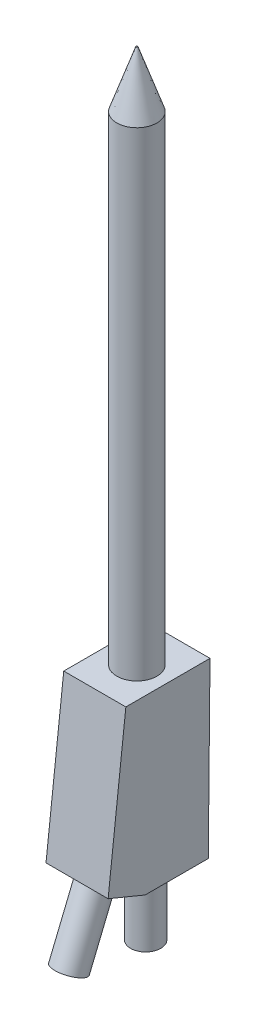
from build123d import *

# Parameters (mm, degrees)
SKETCH1_R           = 2
BOSS_EXTRUDE1_DEPTH = 50
BOSS_EXTRUDE2_DEPTH = 3.1
SKETCH4_R           = 1.5
BOSS_EXTRUDE3_DEPTH = 7
SKETCH5_R           = 1.5
BOSS_EXTRUDE4_DEPTH = 7


with BuildPart() as part:
    # Sketch1 → Boss-Extrude1 (new body)
    with BuildSketch(Plane(origin=(0, 0, 0), x_dir=(1, 0, 0), z_dir=(0, 1, 0))):
        with Locations(Location((0, 0, 0), (0, 0, 270))):
            Circle(SKETCH1_R)
    extrude(amount=BOSS_EXTRUDE1_DEPTH)

    # Sketch2 → Revolve1 (revolve)
    with BuildSketch(Plane.XY):
        Polygon((0, 55.6), (0, 50), (2, 50), (0.078528032, 55.6), align=None)
    revolve(axis=Axis((0, 55.6, 0), (0, -1, 0)))

    # Sketch3 → Boss-Extrude2 (add, symmetric)
    with BuildSketch(Plane(origin=(0, 0, 0), x_dir=(0, 0, -1), z_dir=(1, 0, 0))):
        Polygon((-4.2, 2.171539087), (4.2, 2.171539087), (4.029893124, -15.048329328), (-2.270106876, -15.048329328), (-5.970106876, -13.528460913), align=None)
    extrude(amount=BOSS_EXTRUDE2_DEPTH, both=True)

    # Sketch4 → Boss-Extrude3 (add)
    with BuildSketch(Plane(origin=(0, -13.673600271, 5.616776534), x_dir=(-1, 0, 0), z_dir=(0, -0.9250000000000002, 0.37996710383926635))):
        with Locations(Location((0, 1.618021252, 0), (0, 0, 270))):
            Circle(SKETCH4_R)
    extrude(amount=BOSS_EXTRUDE3_DEPTH)

    # Sketch5 → Boss-Extrude4 (add)
    with BuildSketch(Plane(origin=(0, -15.048329328, 0), x_dir=(-1, 0, 0), z_dir=(0, -1, 0))):
        with Locations(Location((0, 0.879893124, 0), (0, 0, 270))):
            Circle(SKETCH5_R)
    extrude(amount=BOSS_EXTRUDE4_DEPTH)


solid = part.part
